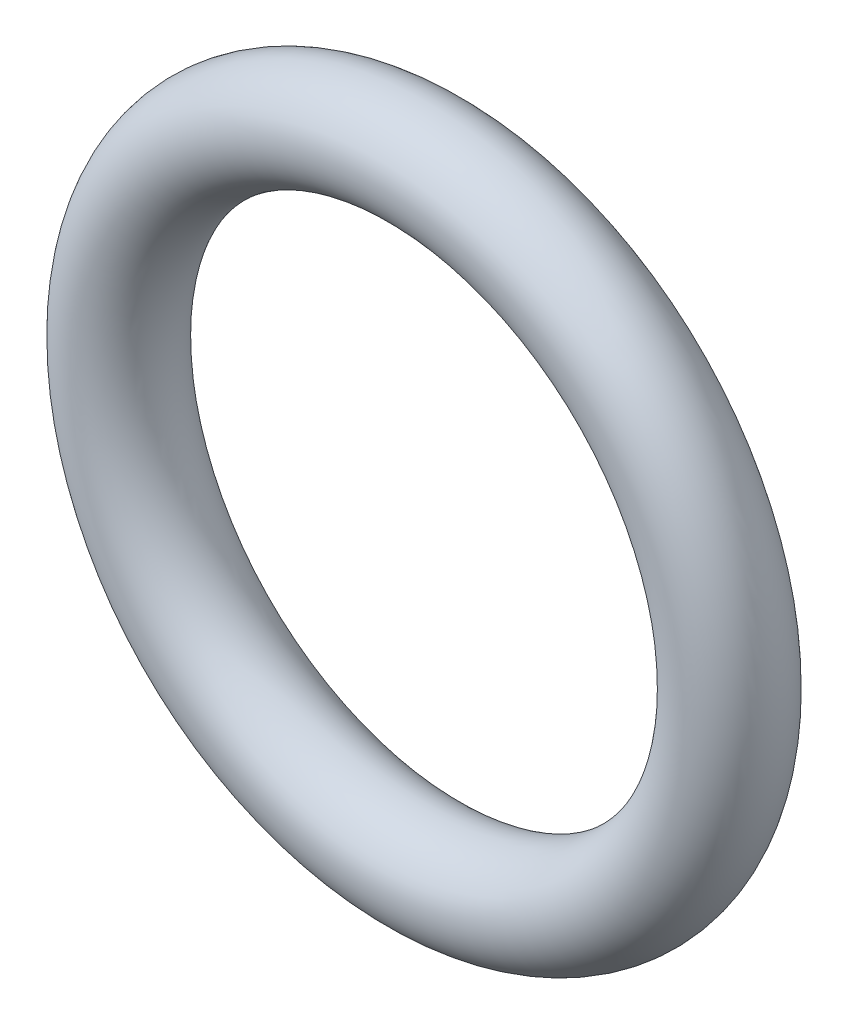
from build123d import *

# Parameters (mm, degrees)
SKETCH1_R = 1


with BuildPart() as part:
    # Sketch1 → Revolve1 (revolve)
    with BuildSketch(Plane(origin=(0, 0, 0), x_dir=(0, 0, -1), z_dir=(1, 0, 0)), mode=Mode.PRIVATE) as revolve1_sk:
        with Locations((0, 6)):
            Circle(SKETCH1_R)
    revolve(revolve1_sk.sketch.rotate(Axis((0, 0, 24.264405023), (0, 0, -1)), 90), axis=Axis((0, 0, 24.264405023), (0, 0, -1)))


solid = part.part
